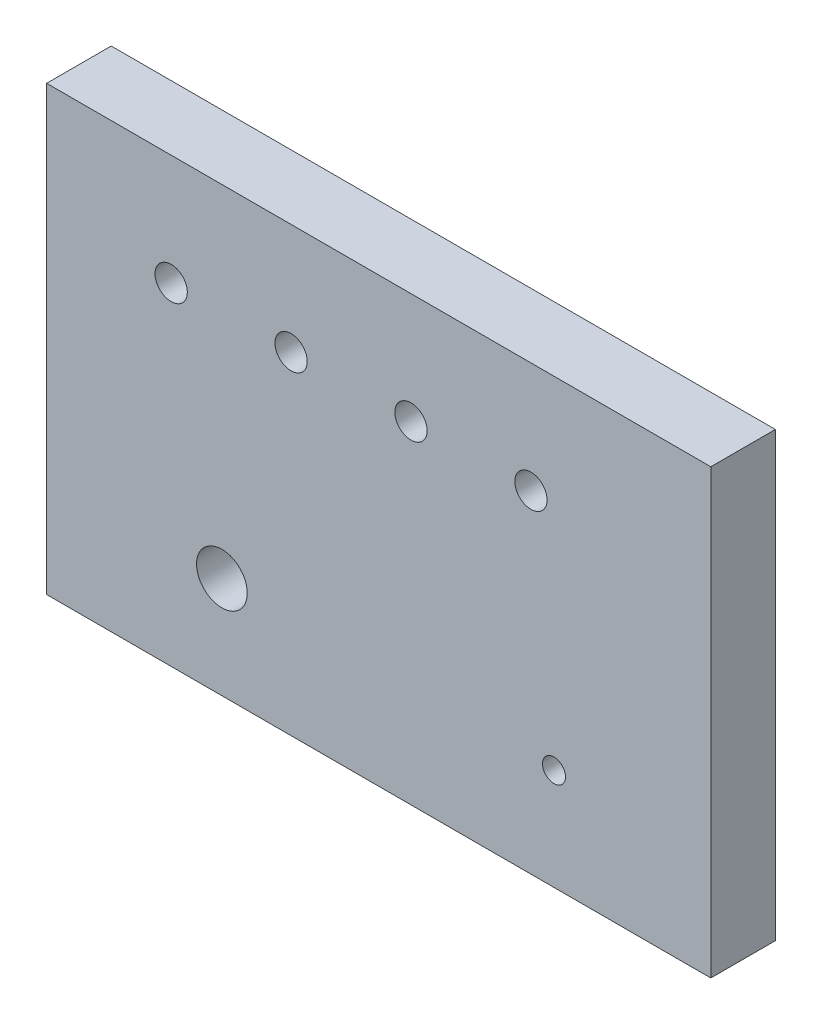
from build123d import *

# Parameters (mm, degrees)
SKETCH_1_W             = 144
SKETCH_1_H             = 96
EXTRUDE_237_DEPTH      = 14
SKETCH_3_R             = 3.5
CUT_EXTRUDE_A_DEPTH    = 88.658428003
PATTERN_LINEAR_2_COUNT = 4
PATTERN_LINEAR_2_PITCH = 26
SKETCH_4_R             = 5.5
CUT_EXTRUDE_B_DEPTH    = 88.658428003
SKETCH_5_R             = 2.5
CUT_EXTRUDE_C_DEPTH    = 88.658428003


with BuildPart() as part:
    # 草图1 → Extrude 237 (new body)
    with BuildSketch(Plane.XY):
        Rectangle(SKETCH_1_W, SKETCH_1_H)
    extrude(amount=EXTRUDE_237_DEPTH)

    # 草图3 → 孔A (cut, through all)
    with BuildSketch(Plane.XY):
        with Locations((-45, 24)):
            Circle(SKETCH_3_R)
    cut_extrude_a = extrude(amount=CUT_EXTRUDE_A_DEPTH, mode=Mode.SUBTRACT)

    # 阵列(线性)2: 孔A ×4
    with Locations(*[(i * PATTERN_LINEAR_2_PITCH, 0, 0) for i in range(1, PATTERN_LINEAR_2_COUNT)]):
        add(cut_extrude_a, mode=Mode.SUBTRACT)

    # 草图4 → 孔B (cut, through all)
    with BuildSketch(Plane.XY):
        with Locations((-34, -26)):
            Circle(SKETCH_4_R)
    extrude(amount=CUT_EXTRUDE_B_DEPTH, mode=Mode.SUBTRACT)

    # 草图5 → 孔C (cut, through all)
    with BuildSketch(Plane.XY):
        with Locations((38, -26)):
            Circle(SKETCH_5_R)
    extrude(amount=CUT_EXTRUDE_C_DEPTH, mode=Mode.SUBTRACT)


solid = part.part
